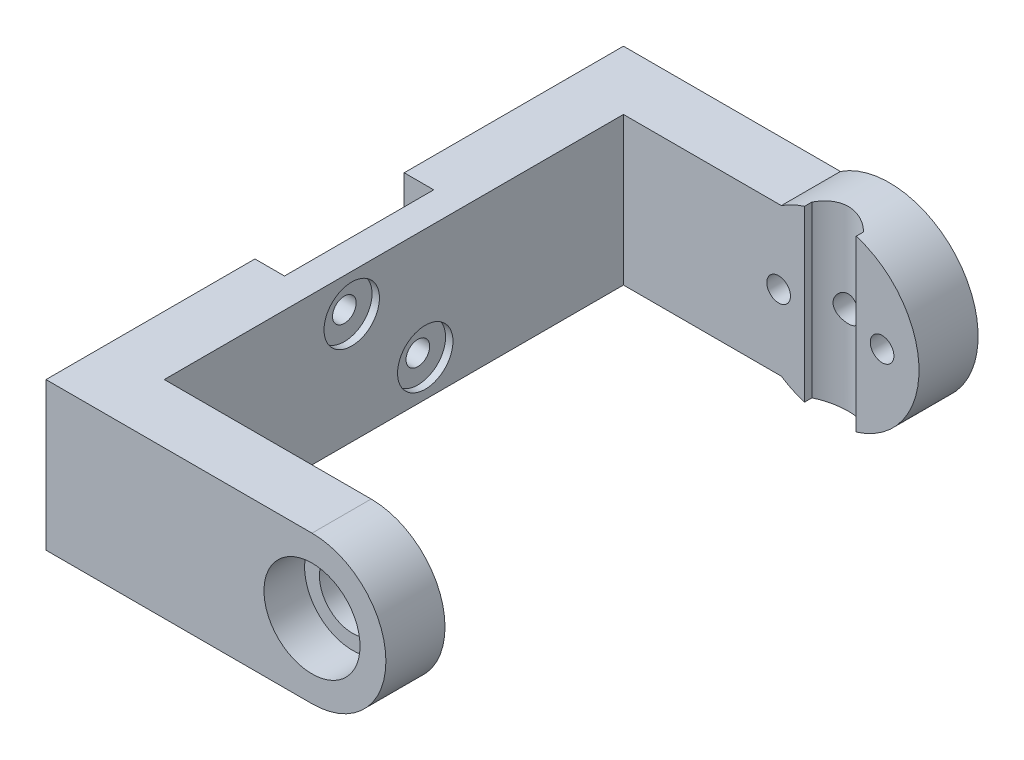
from build123d import *

# Parameters (mm, degrees)
SZKIC25_W                        = 62.15
SZKIC25_H                        = 20
DODANIE_WYCI_GNI_CIE7_DEPTH      = 8
SZKIC14_R                        = 1.75
DODANIE_WYCI_GNI_CIE5_DEPTH      = 8
SZKIC16_R                        = 4.5
DODANIE_WYCI_GNI_CIE6_DEPTH      = 8
SZKIC19_R                        = 6.5
WYTNIJ_WYCI_GNI_CIE8_DEPTH       = 5.5
WYTNIJ_WYCI_GNI_CIE9_REACH       = 94.496
SZKIC20_R                        = 1.6
SZKIC21_R                        = 3.75
WYTNIJ_WYCI_GNI_CIE10_DEPTH      = 3.5
SZKIC22_R                        = 3
WYTNIJ_WYCI_GNI_CIE11_DEPTH      = 2
WYTNIJ_WYCI_GNI_CIE12_REACH      = 68.384
WYTNIJ_WYCI_GNI_CIE12_END_RADIUS = 12
SZKIC26_W                        = 20.2
SZKIC26_H                        = 20
WYTNIJ_WYCI_GNI_CIE13_DEPTH      = 4
WYTNIJ_WYCI_GNI_CIE14_REACH      = 62.057
SZKIC27_R                        = 1.6
SZKIC28_R                        = 3.75
WYTNIJ_WYCI_GNI_CIE15_DEPTH      = 1


with BuildPart() as part:
    # Szkic25 → Dodanie-wyciągnięcie7 (new body)
    with BuildSketch(Plane(origin=(0, 0, 0), x_dir=(0, 0, -1), z_dir=(1, 0, 0))):
        Rectangle(SZKIC25_W, SZKIC25_H)
    extrude(amount=DODANIE_WYCI_GNI_CIE7_DEPTH)

    # Szkic14 → Dodanie-wyciągnięcie5 (add)
    with BuildSketch(Plane(origin=(0, 0, -31.075), x_dir=(-1, 0, 0), z_dir=(0, 0, -1))):
        with BuildLine():
            Line((0, 10), (0, -10))
            Line((0, -10), (-29.366750419, -10))
            ThreePointArc((-29.366750419, -10), (-48, 0), (-29.366750419, 10))
            Line((-29.366750419, 10), (0, 10))
        make_face()
        with Locations((-36, 0)):
            Circle(SZKIC14_R, mode=Mode.SUBTRACT)
    extrude(amount=DODANIE_WYCI_GNI_CIE5_DEPTH)

    # Szkic16 → Dodanie-wyciągnięcie6 (add)
    with BuildSketch(Plane.XY.offset(31.075)):
        with BuildLine():
            Line((0, 10), (0, -10))
            Line((0, -10), (36, -10))
            ThreePointArc((36, -10), (46, 0), (36, 10))
            Line((36, 10), (0, 10))
        make_face()
        with Locations((36, 0)):
            Circle(SZKIC16_R, mode=Mode.SUBTRACT)
    extrude(amount=DODANIE_WYCI_GNI_CIE6_DEPTH)

    # Szkic19 → Wytnij-wyciągnięcie8 (cut)
    with BuildSketch(Plane.XY.offset(39.075)):
        with Locations((36, 0)):
            Circle(SZKIC19_R)
    extrude(amount=-WYTNIJ_WYCI_GNI_CIE8_DEPTH, mode=Mode.SUBTRACT)

    # Szkic20 → Wytnij-wyciągnięcie9 (cut, up to next)
    with BuildSketch(Plane(origin=(0, 0, -39.075), x_dir=(-1, 0, 0), z_dir=(0, 0, -1)), mode=Mode.PRIVATE) as wytnij_wyci_gni_cie9_sk1:
        with Locations(Location((-29, 0, 0), (0, 0, 90))):
            Circle(SZKIC20_R)
    wytnij_wyci_gni_cie9_tool1 = extrude(wytnij_wyci_gni_cie9_sk1.sketch, amount=-WYTNIJ_WYCI_GNI_CIE9_REACH, mode=Mode.PRIVATE) & part.part
    # Szkic20 → Wytnij-wyciągnięcie9 (cut, up to next)
    with BuildSketch(Plane(origin=(0, 0, -39.075), x_dir=(-1, 0, 0), z_dir=(0, 0, -1)), mode=Mode.PRIVATE) as wytnij_wyci_gni_cie9_sk2:
        with Locations(Location((-43, 0, 0), (0, 0, 90))):
            Circle(SZKIC20_R)
    wytnij_wyci_gni_cie9_tool2 = extrude(wytnij_wyci_gni_cie9_sk2.sketch, amount=-WYTNIJ_WYCI_GNI_CIE9_REACH, mode=Mode.PRIVATE) & part.part
    add(wytnij_wyci_gni_cie9_tool1.solids().sort_by_distance((29, 0, -39.075))[0], mode=Mode.SUBTRACT)
    add(wytnij_wyci_gni_cie9_tool2.solids().sort_by_distance((43, 0, -39.075))[0], mode=Mode.SUBTRACT)

    # Szkic21 → Wytnij-wyciągnięcie10 (cut)
    with BuildSketch(Plane(origin=(0, 0, -39.075), x_dir=(-1, 0, 0), z_dir=(0, 0, -1))):
        with Locations(Location((-43, 0, 0), (0, 0, 90))):
            Circle(SZKIC21_R)
        with Locations(Location((-29, 0, 0), (0, 0, 90))):
            Circle(SZKIC21_R)
    extrude(amount=-WYTNIJ_WYCI_GNI_CIE10_DEPTH, mode=Mode.SUBTRACT)

    # Szkic22 → Wytnij-wyciągnięcie11 (cut)
    with BuildSketch(Plane(origin=(0, 0, -39.075), x_dir=(-1, 0, 0), z_dir=(0, 0, -1))):
        with Locations(Location((-36, 0, 0), (0, 0, 90))):
            Circle(SZKIC22_R)
    extrude(amount=-WYTNIJ_WYCI_GNI_CIE11_DEPTH, mode=Mode.SUBTRACT)

    # Wytnij-wyciągnięcie12: up to this cylinder (the profile starts inside it)
    wytnij_wyci_gni_cie12_end = Plane(origin=(36, 0, -32.110303), z_dir=(0, 0, 1)) * Cylinder(WYTNIJ_WYCI_GNI_CIE12_END_RADIUS, 161.768, mode=Mode.PRIVATE)
    # Szkic23 → Wytnij-wyciągnięcie12 (cut, up to the surface)
    with BuildSketch(Plane(origin=(0, 12, 0), x_dir=(1, 0, 0), z_dir=(0, 1, 0)), mode=Mode.PRIVATE) as wytnij_wyci_gni_cie12_sk1:
        with BuildLine():
            Line((32.5, 31.075), (39.5, 31.075))
            Line((39.5, 31.075), (39.5, 32.075))
            ThreePointArc((39.5, 32.075), (36, 33.504285786), (32.5, 32.075))
            Line((32.5, 32.075), (32.5, 31.075))
        make_face()
    wytnij_wyci_gni_cie12_tool1 = extrude(wytnij_wyci_gni_cie12_sk1.sketch, amount=-WYTNIJ_WYCI_GNI_CIE12_REACH, mode=Mode.PRIVATE) & wytnij_wyci_gni_cie12_end
    add(wytnij_wyci_gni_cie12_tool1.solids().sort_by_distance((36, 12, -32.110303))[0], mode=Mode.SUBTRACT)

    # Szkic26 → Wytnij-wyciągnięcie13 (cut)
    with BuildSketch(Plane.ZY):
        with Locations((0.7, 0)):
            Rectangle(SZKIC26_W, SZKIC26_H)
    extrude(amount=-WYTNIJ_WYCI_GNI_CIE13_DEPTH, mode=Mode.SUBTRACT)

    # Szkic27 → Wytnij-wyciągnięcie14 (cut, up to next)
    with BuildSketch(Plane.ZY.offset(-4), mode=Mode.PRIVATE) as wytnij_wyci_gni_cie14_sk1:
        with Locations((5.7, 5)):
            Circle(SZKIC27_R)
    wytnij_wyci_gni_cie14_tool1 = extrude(wytnij_wyci_gni_cie14_sk1.sketch, amount=-WYTNIJ_WYCI_GNI_CIE14_REACH, mode=Mode.PRIVATE) & part.part
    # Szkic27 → Wytnij-wyciągnięcie14 (cut, up to next)
    with BuildSketch(Plane.ZY.offset(-4), mode=Mode.PRIVATE) as wytnij_wyci_gni_cie14_sk2:
        with Locations((-4.250002475, -5.0495025)):
            Circle(SZKIC27_R)
    wytnij_wyci_gni_cie14_tool2 = extrude(wytnij_wyci_gni_cie14_sk2.sketch, amount=-WYTNIJ_WYCI_GNI_CIE14_REACH, mode=Mode.PRIVATE) & part.part
    add(wytnij_wyci_gni_cie14_tool1.solids().sort_by_distance((4, 5, 5.7))[0], mode=Mode.SUBTRACT)
    add(wytnij_wyci_gni_cie14_tool2.solids().sort_by_distance((4, -5.049502, -4.250002))[0], mode=Mode.SUBTRACT)

    # Szkic28 → Wytnij-wyciągnięcie15 (cut)
    with BuildSketch(Plane(origin=(8, 0, 0), x_dir=(0, 0, -1), z_dir=(1, 0, 0))):
        with Locations((-5.7, 5)):
            Circle(SZKIC28_R)
        with Locations((4.250002475, -5.0495025)):
            Circle(SZKIC28_R)
    extrude(amount=-WYTNIJ_WYCI_GNI_CIE15_DEPTH, mode=Mode.SUBTRACT)


solid = part.part
